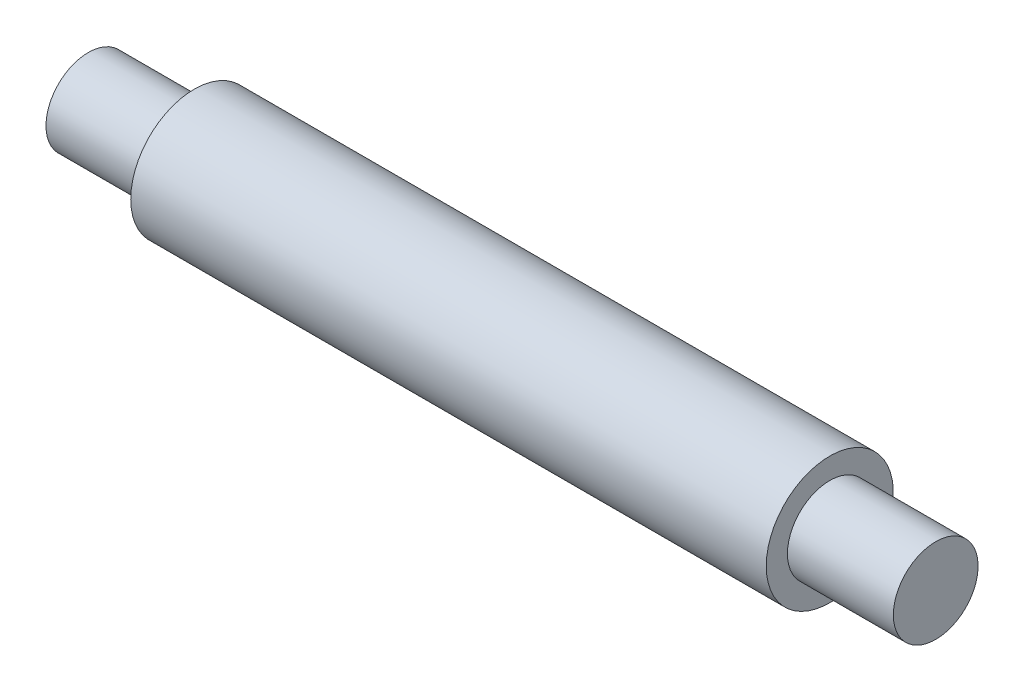
from build123d import *


with BuildPart() as part:
    # Sketch1 → Revolve1 (revolve)
    with BuildSketch(Plane.XY, mode=Mode.PRIVATE) as revolve1_sk:
        Polygon((0, 0), (80, 0), (80, 4), (70, 4), (70, 6), (10, 6), (10, 4), (0, 4), align=None)
    revolve(revolve1_sk.sketch.rotate(Axis((0, 0, 0), (1, 0, 0)), 90), axis=Axis((0, 0, 0), (1, 0, 0)))


solid = part.part
